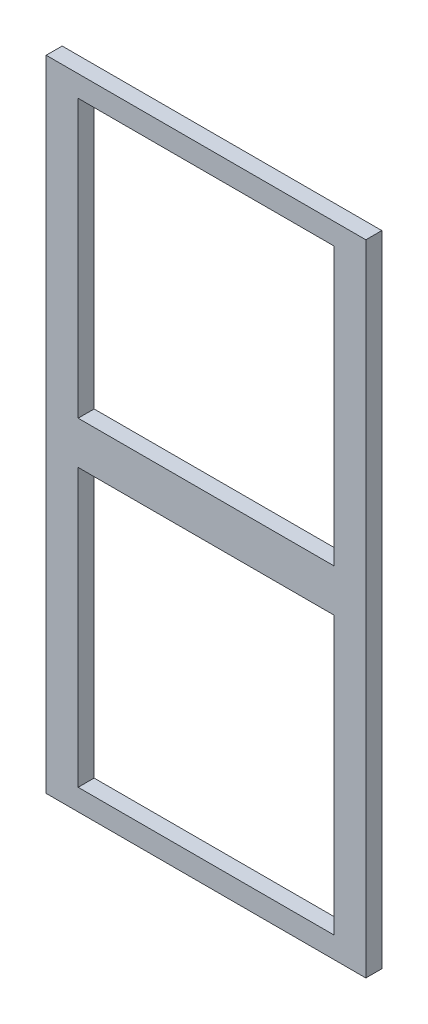
from build123d import *

# Parameters (mm, degrees)
SKETCH_1_W          = 15
SKETCH_1_H          = 30
EXTRUDE_1_DEPTH     = 0.75
SKETCH_2_W          = 12
SKETCH_2_H          = 13
CUT_EXTRUDE_1_DEPTH = 0.75


with BuildPart() as part:
    # 草圖1 → 填料-伸長1 (new body)
    with BuildSketch(Plane.XY):
        Rectangle(SKETCH_1_W, SKETCH_1_H)
    extrude(amount=EXTRUDE_1_DEPTH)

    # 草圖2 → 除料-伸長1 (cut)
    with BuildSketch(Plane.XY.offset(0.75)):
        with Locations((0, 7.5)):
            Rectangle(SKETCH_2_W, SKETCH_2_H)
        with Locations((0, -7.5)):
            Rectangle(SKETCH_2_W, SKETCH_2_H)
    extrude(amount=-CUT_EXTRUDE_1_DEPTH, mode=Mode.SUBTRACT)


solid = part.part
